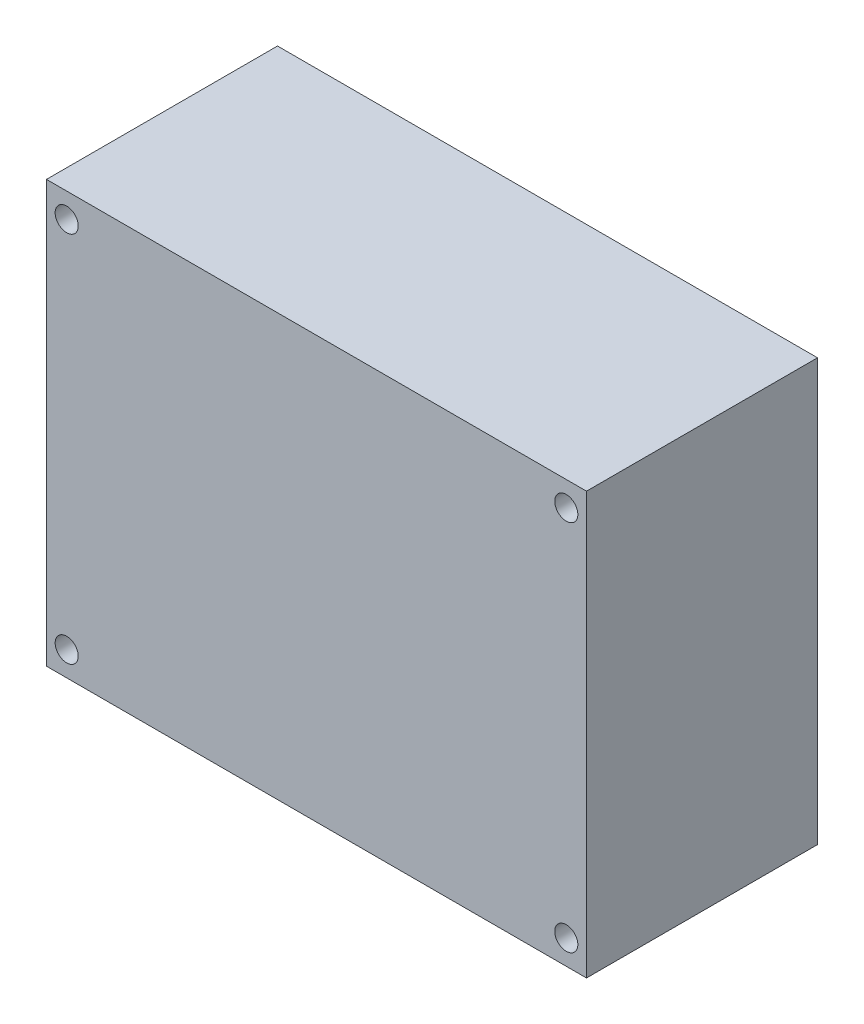
from build123d import *

# Parameters (mm, degrees)
SKIZZE1_W                       = 93.5
SKIZZE1_H                       = 73
AUFSATZ_LINEAR_AUSTRAGEN1_DEPTH = 40
SKIZZE2_R                       = 2
SCHNITT_LINEAR_AUSTRAGEN1_DEPTH = 72.538888026


with BuildPart() as part:
    # Skizze1 → Aufsatz-Linear austragen1 (new body)
    with BuildSketch(Plane.XY):
        Rectangle(SKIZZE1_W, SKIZZE1_H)
    extrude(amount=AUFSATZ_LINEAR_AUSTRAGEN1_DEPTH)

    # Skizze2 → Schnitt-Linear austragen1 (cut, through all)
    with BuildSketch(Plane.XY.offset(40)):
        with Locations((-43.25, 32.25)):
            Circle(SKIZZE2_R)
        with Locations((43.25, 32.25)):
            Circle(SKIZZE2_R)
        with Locations((43.25, -32.25)):
            Circle(SKIZZE2_R)
        with Locations((-43.25, -32.25)):
            Circle(SKIZZE2_R)
    extrude(amount=-SCHNITT_LINEAR_AUSTRAGEN1_DEPTH, mode=Mode.SUBTRACT)


solid = part.part
